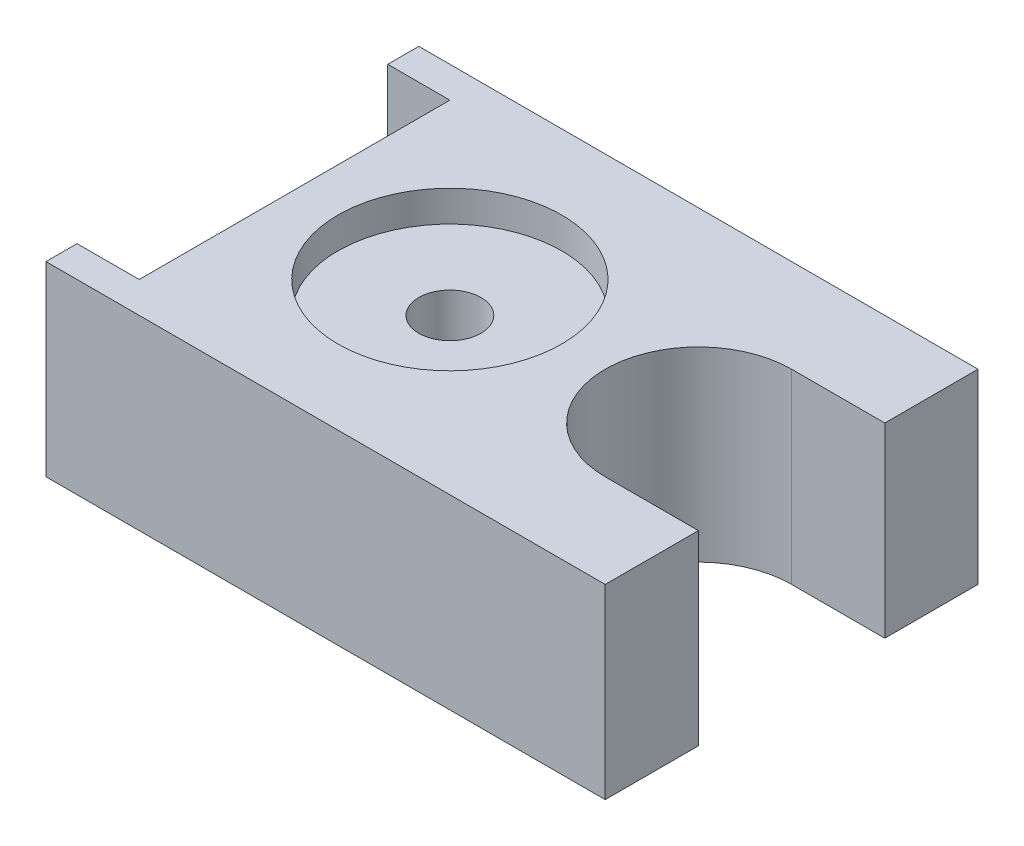
from build123d import *

# Parameters (mm, degrees)
ESBO_O1_W                = 90
ESBO_O1_H                = 60
RESSALTO_EXTRUS_O1_DEPTH = 30
CORTE_EXTRUS_O1_DEPTH    = 113.249721603
ESBO_O18_W               = 50
ESBO_O18_H               = 30
CORTE_EXTRUS_O2_DEPTH    = 10
ESBO_O20_R               = 5
CORTE_EXTRUS_O4_DEPTH    = 113.249721603
ESBO_O22_R               = 18
CORTE_EXTRUS_O5_DEPTH    = 5


with BuildPart() as part:
    # Esboço1 → Ressalto-extrusão1 (new body)
    with BuildSketch(Plane(origin=(0, 0, 0), x_dir=(1, 0, 0), z_dir=(0, 1, 0))):
        with Locations((45, 30)):
            Rectangle(ESBO_O1_W, ESBO_O1_H)
    extrude(amount=RESSALTO_EXTRUS_O1_DEPTH)

    # Esboço2 → Corte-extrusão1 (cut, through all)
    with BuildSketch(Plane(origin=(0, 30, 0), x_dir=(1, 0, 0), z_dir=(0, 1, 0))):
        with BuildLine():
            Line((90, 45), (75, 45))
            ThreePointArc((75, 45), (60, 30), (75, 15))
            Line((75, 15), (90, 15))
            Line((90, 15), (90, 45))
        make_face()
    extrude(amount=-CORTE_EXTRUS_O1_DEPTH, mode=Mode.SUBTRACT)

    # Esboço18 → Corte-extrusão2 (cut)
    with BuildSketch(Plane.ZY):
        with Locations((-30, 15)):
            Rectangle(ESBO_O18_W, ESBO_O18_H)
    extrude(amount=-CORTE_EXTRUS_O2_DEPTH, mode=Mode.SUBTRACT)

    # Esboço20 → Corte-extrusão4 (cut, through all)
    with BuildSketch(Plane(origin=(0, 30, 0), x_dir=(1, 0, 0), z_dir=(0, 1, 0))):
        with Locations(Location((35, 30, 0), (0, 0, 270))):
            Circle(ESBO_O20_R)
    extrude(amount=-CORTE_EXTRUS_O4_DEPTH, mode=Mode.SUBTRACT)

    # Esboço22 → Corte-extrusão5 (cut)
    with BuildSketch(Plane(origin=(0, 30, 0), x_dir=(1, 0, 0), z_dir=(0, 1, 0))):
        with Locations(Location((35, 30, 0), (0, 0, 270))):
            Circle(ESBO_O22_R)
    extrude(amount=-CORTE_EXTRUS_O5_DEPTH, mode=Mode.SUBTRACT)


solid = part.part
